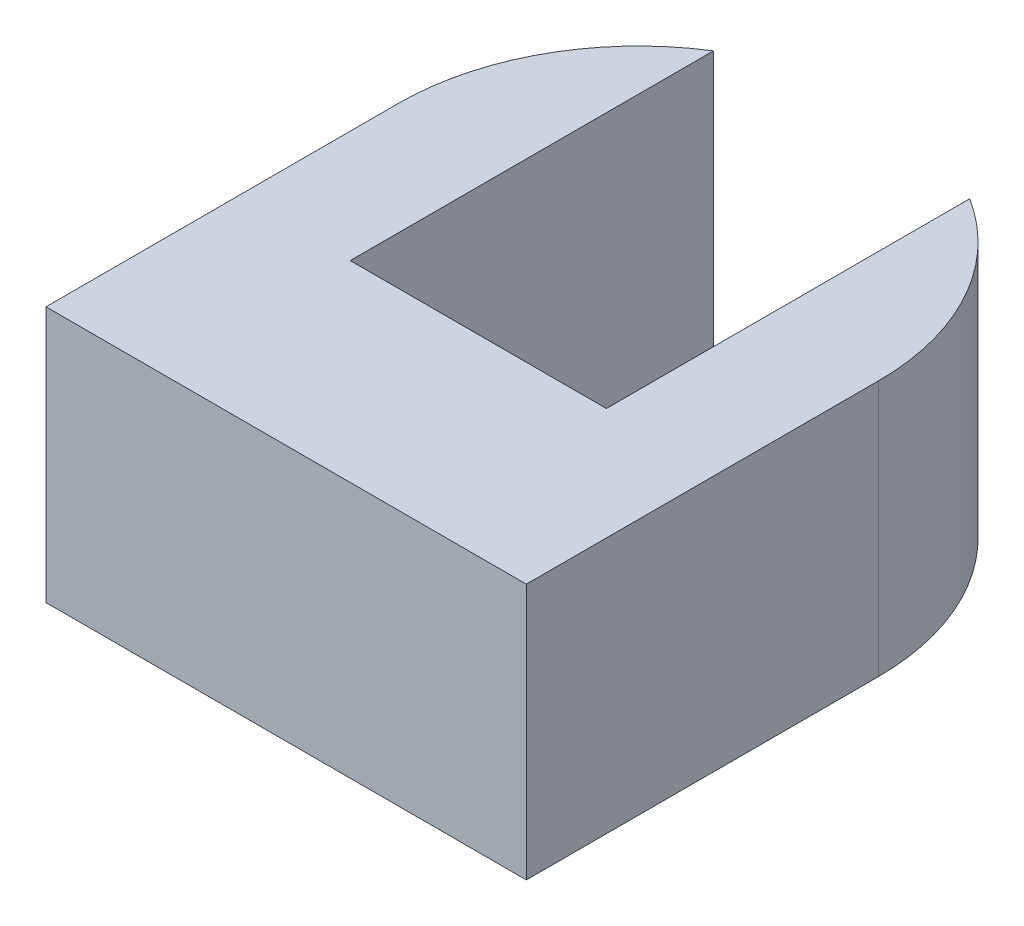
from build123d import *

# Parameters (mm, degrees)
BOSS_EXTRUDE1_DEPTH = 8


with BuildPart() as part:
    # Sketch1 → Boss-Extrude1 (new body)
    with BuildSketch(Plane(origin=(0, 0, 0), x_dir=(1, 0, 0), z_dir=(0, 1, 0))):
        with BuildLine():
            Line((0, 11), (0, 0))
            Line((0, 0), (15, 0))
            Line((15, 0), (15, 11))
            ThreePointArc((15, 11), (14.066962768, 14.622844187), (11.5, 17.34428877))
            Line((11.5, 17.34428877), (11.5, 6))
            Line((11.5, 6), (3.5, 6))
            Line((3.5, 6), (3.5, 17.34428877))
            ThreePointArc((3.5, 17.34428877), (0.933037232, 14.622844187), (0, 11))
        make_face()
    extrude(amount=BOSS_EXTRUDE1_DEPTH)


solid = part.part
